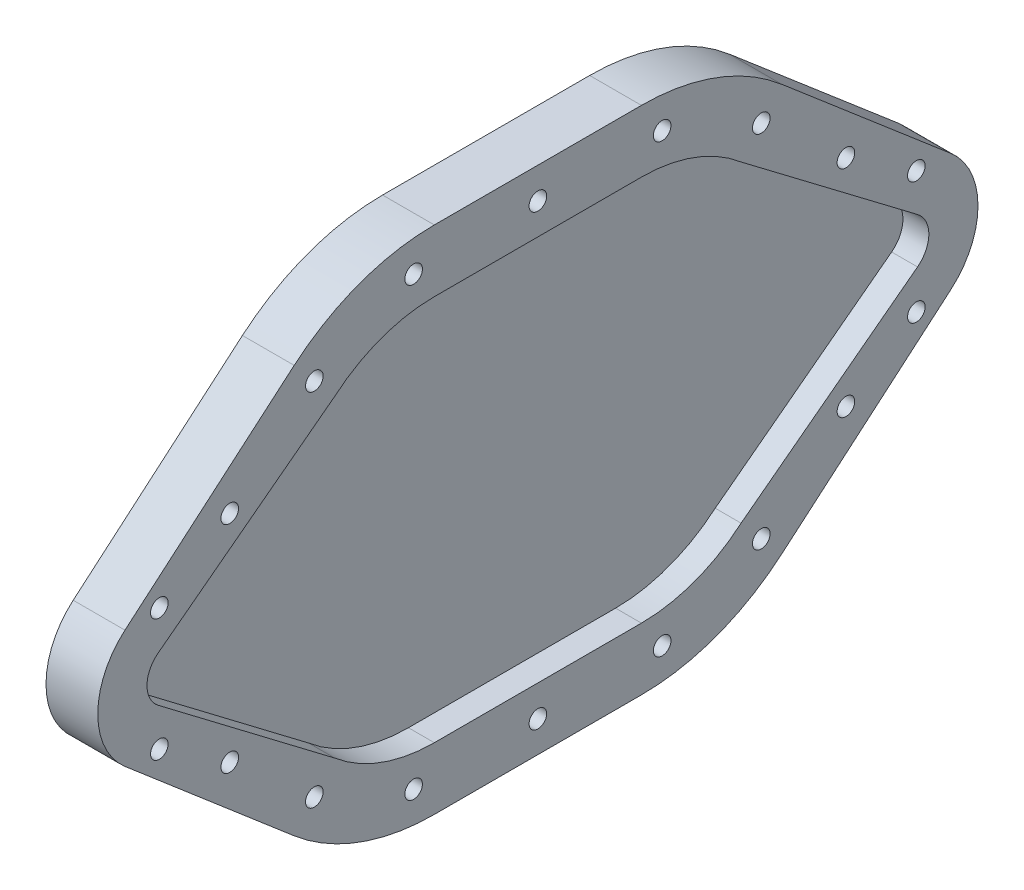
from build123d import *

# Parameters (mm, degrees)
SKETCH1_R               = 19.05
BOSS_EXTRUDE1_DEPTH     = 12.7
CUT_EXTRUDE1_DEPTH      = 6.35
CUT_EXTRUDE3_DEPTH      = 126.437752774
CUT_EXTRUDE3_DEPTH_BACK = 126.437752774
SKETCH4_R               = 2.159


with BuildPart() as part:
    # Sketch1 → Boss-Extrude1 (new body)
    with BuildSketch(Plane(origin=(0, 0, 0), x_dir=(0, 0, -1), z_dir=(1, 0, 0))):
        with BuildLine():
            Line((25.4, 62.611), (-25.4, 62.611))
            ThreePointArc((-25.4, 62.611), (-43.71389723, 59.350669702), (-59.777434529, 49.970298982))
            Line((-59.777434529, 49.970298982), (-101.281034529, 14.478))
            ThreePointArc((-101.281034529, 14.478), (-80.929937509, 17.302618411), (-69.85, 0))
            ThreePointArc((-69.85, 0), (-80.929937509, -17.302618411), (-101.281034529, -14.478))
            Line((-101.281034529, -14.478), (-59.777434529, -49.970298982))
            ThreePointArc((-59.777434529, -49.970298982), (-43.71389723, -59.350669702), (-25.4, -62.611))
            Line((-25.4, -62.611), (25.4, -62.611))
            ThreePointArc((25.4, -62.611), (43.699078076, -59.34404997), (59.737214243, -49.946847768))
            Line((59.737214243, -49.946847768), (101.269374674, -14.487973703))
            ThreePointArc((101.269374674, -14.487973703), (69.85, -7.706e-06), (101.269379322, 14.48794821))
            Line((101.269379322, 14.48794821), (59.737230268, 49.9468356))
            ThreePointArc((59.737230268, 49.9468356), (43.699087699, 59.344046737), (25.4, 62.611))
        make_face()
        with Locations((88.9, -1.0762e-05)):
            Circle(SKETCH1_R)
        with Locations((-88.9, 0)):
            Circle(SKETCH1_R)
    extrude(amount=BOSS_EXTRUDE1_DEPTH)

    # Sketch2 → Cut-Extrude1 (cut)
    with BuildSketch(Plane(origin=(12.7, 0, 0), x_dir=(0, 0, -1), z_dir=(1, 0, 0))):
        with BuildLine():
            Line((-49.889980522, 38.373041727), (-93.122597105, 5.564161993))
            ThreePointArc((-93.122597105, 5.564161993), (-95.885, 0), (-93.122597105, -5.564161993))
            Line((-93.122597105, -5.564161993), (-49.889980522, -38.373041727))
            ThreePointArc((-49.889980522, -38.373041727), (-38.445328657, -45.050322999), (-25.4, -47.371))
            Line((-25.4, -47.371), (25.4, -47.371))
            ThreePointArc((25.4, -47.371), (38.425542458, -45.045538785), (49.841714504, -38.356477415))
            Line((49.841714504, -38.356477415), (93.118252802, -5.56746694))
            ThreePointArc((93.118252802, -5.56746694), (95.885, -1.1883e-05), (93.118254588, 5.567444063))
            Line((93.118254588, 5.567444063), (49.84172681, 38.356468422))
            ThreePointArc((49.84172681, 38.356468422), (38.425549787, 45.045536399), (25.4, 47.371))
            Line((25.4, 47.371), (-25.4, 47.371))
            ThreePointArc((-25.4, 47.371), (-38.445328657, 45.050322999), (-49.889980522, 38.373041727))
        make_face()
    extrude(amount=-CUT_EXTRUDE1_DEPTH, mode=Mode.SUBTRACT)

    # Sketch4 → Cut-Extrude3 (cut, two sides: drawn at the far end of the back side and taken through both)
    with BuildSketch(Plane(origin=(12.7, 0, 0), x_dir=(0, 0, -1), z_dir=(1, 0, 0)).offset(-CUT_EXTRUDE3_DEPTH_BACK)):
        with BuildLine():
            ThreePointArc((-73.940141084, 27.832575617), (-76.984164998, 28.070231704), (-77.221821084, 25.02620779))
            Line((-77.221821084, 25.02620779), (-73.940141084, 27.832575617))
        make_face()
        with BuildLine():
            Line((-73.940141084, 27.832575617), (-77.221821084, 25.02620779))
            ThreePointArc((-77.221821084, 25.02620779), (-74.833081546, 24.404070178), (-73.421981084, 26.429391704))
            ThreePointArc((-73.421981084, 26.429391704), (-73.555659559, 27.177291242), (-73.940141084, 27.832575617))
        make_face()
        with Locations((-54.833341451, 44.171983407)):
            Circle(SKETCH4_R)
        with Locations((-30.48, 54.706186836)):
            Circle(SKETCH4_R)
        with Locations((0, 54.991)):
            Circle(SKETCH4_R)
        with Locations((30.478659799, 54.70517335)):
            Circle(SKETCH4_R)
        with Locations((54.789478539, 44.151652011)):
            Circle(SKETCH4_R)
        with Locations((75.555553066, 26.422208316)):
            Circle(SKETCH4_R)
        with Locations((92.827553066, 14.992208316)):
            Circle(SKETCH4_R)
        with Locations((92.827553066, -14.992208316)):
            Circle(SKETCH4_R)
        with Locations((75.555553066, -26.422208316)):
            Circle(SKETCH4_R)
        with Locations((54.789478539, -44.151652011)):
            Circle(SKETCH4_R)
        with Locations((30.478659799, -54.70517335)):
            Circle(SKETCH4_R)
        with Locations((0, -54.991)):
            Circle(SKETCH4_R)
        with Locations((-30.48, -54.706186836)):
            Circle(SKETCH4_R)
        with Locations((-54.833341451, -44.171983407)):
            Circle(SKETCH4_R)
        with Locations((-75.580981084, -26.429391704)):
            Circle(SKETCH4_R)
        with Locations((-92.852981084, -14.999391704)):
            Circle(SKETCH4_R)
        with Locations((-92.852981084, 14.999391704)):
            Circle(SKETCH4_R)
    extrude(amount=CUT_EXTRUDE3_DEPTH + CUT_EXTRUDE3_DEPTH_BACK, mode=Mode.SUBTRACT)


solid = part.part
